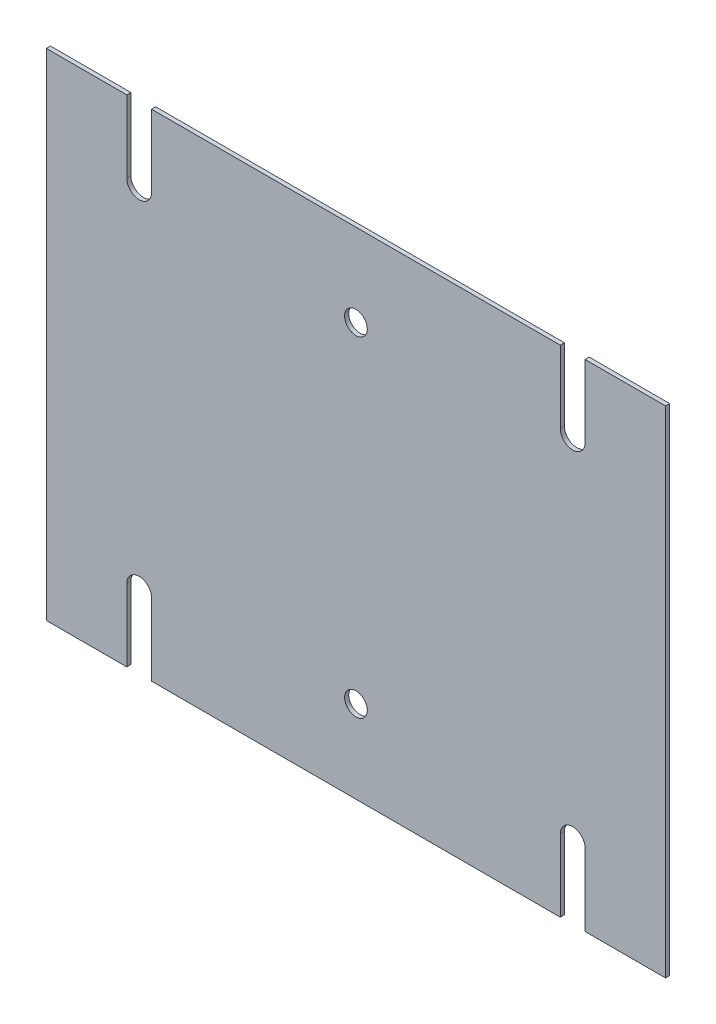
from build123d import *

# Parameters (mm, degrees)
SKETCH1_R               = 5.5
SKETCH1_R_2             = 3.25
BOSS_EXTRUDE1_DEPTH     = 2
CUT_EXTRUDE1_DEPTH      = 319.029152687
CUT_EXTRUDE1_DEPTH_BACK = 319.029152687
SKETCH2_W               = 30
SKETCH2_H               = 70
CUT_EXTRUDE2_DEPTH      = 319.029152687
CUT_EXTRUDE2_DEPTH_BACK = 319.029152687
SKETCH3_W               = 30
SKETCH3_H               = 70


with BuildPart() as part:
    # Sketch1 → Boss-Extrude1 (new body)
    with BuildSketch(Plane.XY):
        with BuildLine():
            Line((68.948821818, -26.633764286), (98.948821818, -26.633764286))
            Line((98.948821818, -26.633764286), (98.948821818, -96.633764286))
            Line((98.948821818, -96.633764286), (68.948821818, -96.633764286))
            Line((68.948821818, -96.633764286), (68.948821818, -181.633764286))
            Line((68.948821818, -181.633764286), (29.948821818, -181.633764286))
            Line((29.948821818, -181.633764286), (29.948821818, -146.633764286))
            ThreePointArc((29.948821818, -146.633764286), (23.948821818, -140.633764286), (17.948821818, -146.633764286))
            Line((17.948821818, -146.633764286), (17.948821818, -181.633764286))
            Line((17.948821818, -181.633764286), (-180.051178182, -181.633764286))
            Line((-180.051178182, -181.633764286), (-180.051178182, -146.633764286))
            ThreePointArc((-180.051178182, -146.633764286), (-186.051178182, -140.633764286), (-192.051178182, -146.633764286))
            Line((-192.051178182, -146.633764286), (-192.051178182, -181.633764286))
            Line((-192.051178182, -181.633764286), (-231.051178182, -181.633764286))
            Line((-231.051178182, -181.633764286), (-231.051178182, -100.179856115))
            Line((-231.051178182, -100.179856115), (-261.051178182, -100.179856115))
            Line((-261.051178182, -100.179856115), (-261.051178182, -30.179856115))
            Line((-261.051178182, -30.179856115), (-231.051178182, -30.179856115))
            Line((-231.051178182, -30.179856115), (-231.051178182, 58.366235714))
            Line((-231.051178182, 58.366235714), (-192.051178182, 58.366235714))
            Line((-192.051178182, 58.366235714), (-192.051178182, 23.366235714))
            ThreePointArc((-192.051178182, 23.366235714), (-186.051178182, 17.366235714), (-180.051178182, 23.366235714))
            Line((-180.051178182, 23.366235714), (-180.051178182, 58.366235714))
            Line((-180.051178182, 58.366235714), (17.948821818, 58.366235714))
            Line((17.948821818, 58.366235714), (17.948821818, 23.366235714))
            ThreePointArc((17.948821818, 23.366235714), (23.948821818, 17.366235714), (29.948821818, 23.366235714))
            Line((29.948821818, 23.366235714), (29.948821818, 58.366235714))
            Line((29.948821818, 58.366235714), (68.948821818, 58.366235714))
            Line((68.948821818, 58.366235714), (68.948821818, -26.633764286))
        make_face()
        with Locations((-81.051178182, -141.633764286)):
            Circle(SKETCH1_R, mode=Mode.SUBTRACT)
        with Locations((-81.051178182, 18.366235714)):
            Circle(SKETCH1_R, mode=Mode.SUBTRACT)
        with Locations((83.948821818, -61.633764286)):
            Circle(SKETCH1_R_2, mode=Mode.SUBTRACT)
        with Locations((-246.051178182, -65.179856115)):
            Circle(SKETCH1_R_2, mode=Mode.SUBTRACT)
    extrude(amount=BOSS_EXTRUDE1_DEPTH)

    # Sketch2 → Cut-Extrude1 (cut, two sides: drawn at the far end of the back side and taken through both)
    with BuildSketch(Plane.XY.offset(2).offset(-CUT_EXTRUDE1_DEPTH_BACK)):
        with Locations((83.948821818, -61.633764286)):
            Rectangle(SKETCH2_W, SKETCH2_H)
    extrude(amount=CUT_EXTRUDE1_DEPTH + CUT_EXTRUDE1_DEPTH_BACK, mode=Mode.SUBTRACT)

    # Sketch3 → Cut-Extrude2 (cut, two sides: drawn at the far end of the back side and taken through both)
    with BuildSketch(Plane.XY.offset(2).offset(-CUT_EXTRUDE2_DEPTH_BACK)):
        with Locations((-246.051178182, -65.179856115)):
            Rectangle(SKETCH3_W, SKETCH3_H)
    extrude(amount=CUT_EXTRUDE2_DEPTH + CUT_EXTRUDE2_DEPTH_BACK, mode=Mode.SUBTRACT)


solid = part.part
